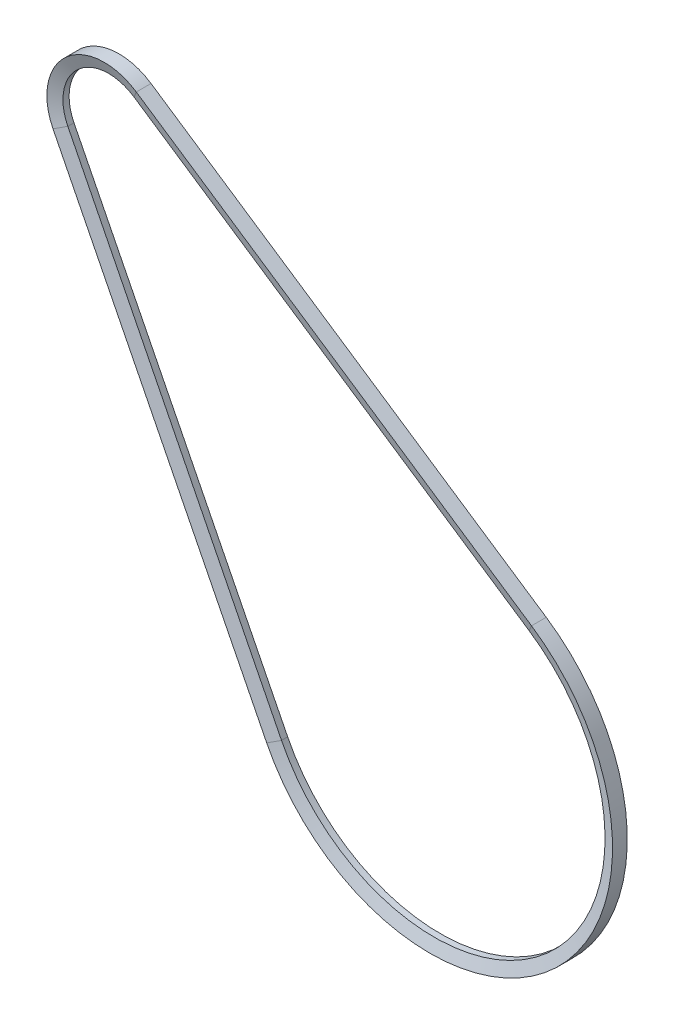
from build123d import *


with BuildPart() as part:
    # Sweep1: sweep along a path in Sketch2
    with BuildLine(Plane.XY) as sweep1_path:
        Line((16.693043668, 24.926738517), (284.990000729, -154.747502353))
        ThreePointArc((284.990000729, -154.747502353), (297.114961728, -336.50622136), (118.257575198, -301.962308754))
        Line((118.257575198, -301.962308754), (-26.802371687, -13.477124023))
        ThreePointArc((-26.802371687, -13.477124023), (-19.856076973, 22.488579485), (16.693043668, 24.926738517))
    # Sketch3 → Sweep1 (sweep)
    with BuildSketch(Plane(origin=(16.693043668, 24.926738517, 0), x_dir=(0, 0, -1), z_dir=(0.830891283891076, -0.5564347889500075, 0))):
        Polygon((2.088238126, 1), (-2.088238126, 1), (-5, 9), (5, 9), align=None)
    sweep(path=sweep1_path.line)


solid = part.part
